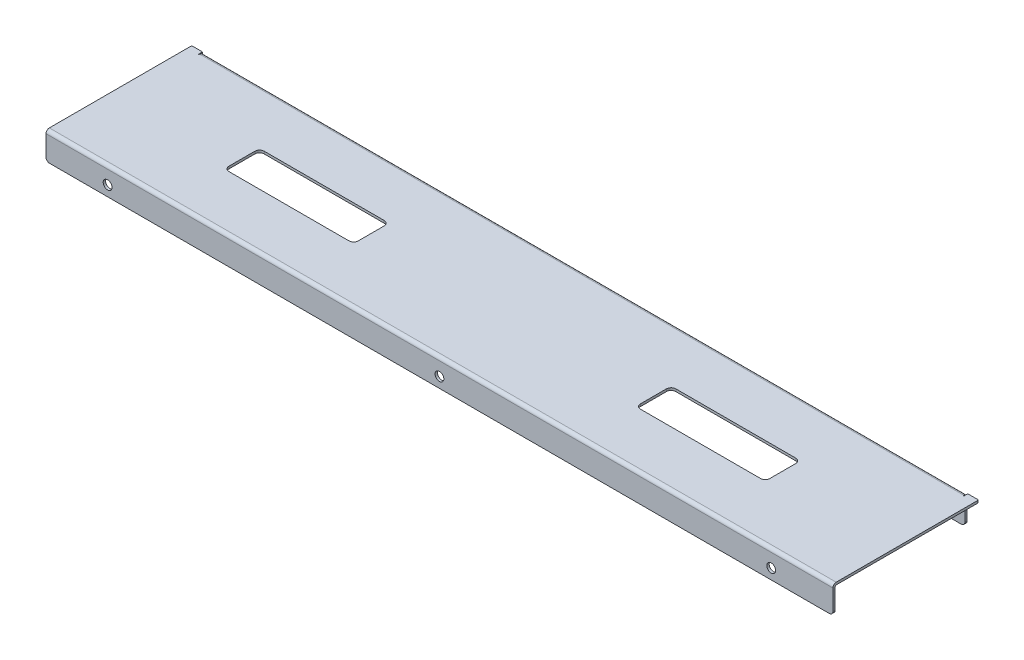
from build123d import *

# Parameters (mm, degrees)
BOSS_EXTRUDE1_DEPTH                = 12.9032
BOSS_EXTRUDE2_DEPTH                = 0.508
CUT_EXTRUDE1_DEPTH                 = 12.9032
BOSS_EXTRUDE3_DEPTH                = 1.2954
CUT_EXTRUDE2_DEPTH                 = 0.508
BOSS_EXTRUDE4_DEPTH                = 0.3048
BOSS_EXTRUDE5_DEPTH                = 0.508
SKETCH8_W                          = 412.6484
SKETCH8_H                          = 0.508
CUT_EXTRUDE3_DEPTH                 = 0.3048
SKETCH9_W                          = 412.6484
SKETCH9_H                          = 1.8034
BOSS_EXTRUDE6_DEPTH                = 1.2954
SKETCH10_W                         = 412.6484
SKETCH10_H                         = 0.508
CUT_EXTRUDE4_DEPTH                 = 0.508
SKETCH11_W                         = 412.6484
SKETCH11_H                         = 1.2954
BOSS_EXTRUDE7_DEPTH                = 12.9032
SKETCH12_W                         = 5.8166
SKETCH12_H                         = 1.2954
BOSS_EXTRUDE8_DEPTH                = 2.1082
SKETCH13_W                         = 5.8166
SKETCH13_H                         = 1.2954
BOSS_EXTRUDE9_DEPTH                = 2.1082
HOLE1_D                            = 4.953
HOLE1_DEPTH                        = 1.2954
F_3_16_0_1875_DIAMETER_HOLE1_D     = 4.7625
F_3_16_0_1875_DIAMETER_HOLE1_DEPTH = 78.6892
FILLET1_R                          = 0.508
FILLET2_R                          = 1.8034
FILLET3_R                          = 1.904999999
CUT_EXTRUDE5_DEPTH                 = 435.13094631


with BuildPart() as part:
    # Sketch1 → Boss-Extrude1 (new body)
    with BuildSketch(Plane.XZ.offset(-290.0934)):
        Polygon((426.4406, 80.2386), (1.5494, 80.2386), (1.5494, 78.9432), (1.5494, 78.4352), (1.5494, 3.6576), (426.4406, 3.6576), (426.4406, 78.4352), (426.4406, 78.9432), align=None)
    extrude(amount=-BOSS_EXTRUDE1_DEPTH)

    # Sketch2 → Boss-Extrude2 (add)
    with BuildSketch(Plane(origin=(0, 302.9966, 0), x_dir=(-1, 0, 0), z_dir=(0, 1, 0))):
        Polygon((-1.5494, 3.6576), (-426.4406, 3.6576), (-426.4406, 78.4352), (-426.4406, 78.943205), (-426.4406, 80.2386), (-1.5494, 80.2386), (-1.5494, 78.943205), (-1.5494, 78.4352), align=None)
    extrude(amount=BOSS_EXTRUDE2_DEPTH)

    # Sketch3 → Cut-Extrude1 (cut)
    with BuildSketch(Plane.XZ.offset(-290.0934)):
        Polygon((1.5494, 3.6576), (426.4406, 3.6576), (426.4406, 78.4352), (426.4406, 78.9432), (1.5494, 78.9432), (1.5494, 78.4352), align=None)
    extrude(amount=-CUT_EXTRUDE1_DEPTH, mode=Mode.SUBTRACT)

    # Sketch4 → Boss-Extrude3 (add)
    with BuildSketch(Plane(origin=(0, 303.5046, 0), x_dir=(-1, 0, 0), z_dir=(0, 1, 0))):
        Polygon((-1.5494, 3.6576), (-426.4406, 3.6576), (-426.4406, 78.4352), (-426.4406, 80.2386), (-1.5494, 80.2386), (-1.5494, 78.4352), align=None)
    extrude(amount=BOSS_EXTRUDE3_DEPTH)

    # Sketch5 → Cut-Extrude2 (cut)
    with BuildSketch(Plane.XZ.offset(-302.9966)):
        Polygon((1.5494, 3.6576), (426.4406, 3.6576), (426.4406, 78.4352), (426.4406, 78.9432), (1.5494, 78.9432), (1.5494, 78.4352), align=None)
    extrude(amount=-CUT_EXTRUDE2_DEPTH, mode=Mode.SUBTRACT)

    # Sketch6 → Boss-Extrude4 (add)
    with BuildSketch(Plane(origin=(0, 0, 3.6576), x_dir=(-1, 0, 0), z_dir=(0, 0, -1))):
        Polygon((-420.3192, 302.9966), (-420.3192, 303.5046), (-420.3192, 304.8), (-7.6708, 304.8), (-7.6708, 303.5046), (-7.6708, 302.9966), align=None)
    extrude(amount=BOSS_EXTRUDE4_DEPTH)

    # Sketch7 → Boss-Extrude5 (add)
    with BuildSketch(Plane(origin=(0, 0, 3.3528), x_dir=(-1, 0, 0), z_dir=(0, 0, -1))):
        Polygon((-420.3192, 302.9966), (-420.3192, 303.5046), (-420.3192, 304.8), (-7.6708, 304.8), (-7.6708, 303.504605), (-7.6708, 302.9966), align=None)
    extrude(amount=BOSS_EXTRUDE5_DEPTH)

    # Sketch8 → Cut-Extrude3 (cut)
    with BuildSketch(Plane.XY.offset(3.6576)):
        with Locations((213.995, 303.2506)):
            Rectangle(SKETCH8_W, SKETCH8_H)
    extrude(amount=-CUT_EXTRUDE3_DEPTH, mode=Mode.SUBTRACT)

    # Sketch9 → Boss-Extrude6 (add)
    with BuildSketch(Plane(origin=(0, 0, 2.8448), x_dir=(-1, 0, 0), z_dir=(0, 0, -1))):
        with Locations((-213.995, 303.8983)):
            Rectangle(SKETCH9_W, SKETCH9_H)
    extrude(amount=BOSS_EXTRUDE6_DEPTH)

    # Sketch10 → Cut-Extrude4 (cut)
    with BuildSketch(Plane.XY.offset(3.3528)):
        with Locations((213.995, 303.2506)):
            Rectangle(SKETCH10_W, SKETCH10_H)
    extrude(amount=-CUT_EXTRUDE4_DEPTH, mode=Mode.SUBTRACT)

    # Sketch11 → Boss-Extrude7 (add)
    with BuildSketch(Plane.XZ.offset(-302.9966)):
        with Locations((213.995, 2.1971)):
            Rectangle(SKETCH11_W, SKETCH11_H)
    extrude(amount=BOSS_EXTRUDE7_DEPTH)

    # Sketch12 → Boss-Extrude8 (add)
    with BuildSketch(Plane(origin=(0, 0, 3.6576), x_dir=(-1, 0, 0), z_dir=(0, 0, -1))):
        with Locations((-4.4577, 304.1523)):
            Rectangle(SKETCH12_W, SKETCH12_H)
    extrude(amount=BOSS_EXTRUDE8_DEPTH)

    # Sketch13 → Boss-Extrude9 (add)
    with BuildSketch(Plane(origin=(0, 0, 3.6576), x_dir=(-1, 0, 0), z_dir=(0, 0, -1))):
        with Locations((-423.5323, 304.1523)):
            Rectangle(SKETCH13_W, SKETCH13_H)
    extrude(amount=BOSS_EXTRUDE9_DEPTH)

    # Hole1
    with Locations(Plane(origin=(0, 0, 1.5494), x_dir=(-1, 0, 0), z_dir=(0, 0, -1))):
        with Locations((-213.995, 295.9989), (-393.1666, 295.9989), (-34.8234, 295.9989)):
            Hole(HOLE1_D / 2, depth=HOLE1_DEPTH)

    # 3/16 (0.1875) Diameter Hole1
    with Locations(Plane.XY.offset(80.2386)):
        with Locations((34.8234, 295.68775), (213.995, 295.68775), (393.1666, 295.68775)):
            Hole(F_3_16_0_1875_DIAMETER_HOLE1_D / 2, depth=F_3_16_0_1875_DIAMETER_HOLE1_DEPTH)

    # Fillet1
    fillet1_edges = [part.edges().sort_by_distance(p)[0] for p in [
        (213.995, 303.5046, 2.8448),
        (1.5494, 304.1523, 1.5494),
        (426.4406, 304.1523, 1.5494),
        (213.995, 303.5046, 78.9432),
    ]]
    fillet(fillet1_edges, radius=FILLET1_R)

    # Fillet2
    fillet2_edges = [part.edges().sort_by_distance(p)[0] for p in [
        (213.995, 304.8, 1.5494),
        (213.995, 304.8, 80.2386),
    ]]
    fillet(fillet2_edges, radius=FILLET2_R)

    # Fillet3
    fillet3_edges = [part.edges().sort_by_distance(p)[0] for p in [
        (420.3192, 290.0934, 2.1971),
        (7.6708, 290.0934, 2.1971),
        (426.4406, 290.0934, 79.5909),
        (1.5494, 290.0934, 79.5909),
    ]]
    fillet(fillet3_edges, radius=FILLET3_R)

    # Sketch18 → Cut-Extrude5 (cut, through all)
    with BuildSketch(Plane.XZ.offset(-303.5046)):
        with BuildLine():
            Line((357.505, 50.3682), (292.735, 50.3682))
            ThreePointArc((292.735, 50.3682), (290.938948776, 49.624251224), (290.195, 47.8282))
            Line((290.195, 47.8282), (290.195, 33.8582))
            ThreePointArc((290.195, 33.8582), (290.938948776, 32.062148776), (292.735, 31.3182))
            Line((292.735, 31.3182), (357.505, 31.3182))
            ThreePointArc((357.505, 31.3182), (359.301051224, 32.062148776), (360.045, 33.8582))
            Line((360.045, 33.8582), (360.045, 47.8282))
            ThreePointArc((360.045, 47.8282), (359.301051224, 49.624251224), (357.505, 50.3682))
        make_face()
        with BuildLine():
            Line((137.795, 47.8282), (137.795, 33.8582))
            ThreePointArc((137.795, 33.8582), (137.051051224, 32.062148776), (135.255, 31.3182))
            Line((135.255, 31.3182), (70.485, 31.3182))
            ThreePointArc((70.485, 31.3182), (68.688948776, 32.062148776), (67.945, 33.8582))
            Line((67.945, 33.8582), (67.945, 47.8282))
            ThreePointArc((67.945, 47.8282), (68.688948776, 49.624251224), (70.485, 50.3682))
            Line((70.485, 50.3682), (135.255, 50.3682))
            ThreePointArc((135.255, 50.3682), (137.051051224, 49.624251224), (137.795, 47.8282))
        make_face()
    extrude(amount=-CUT_EXTRUDE5_DEPTH, mode=Mode.SUBTRACT)


solid = part.part
